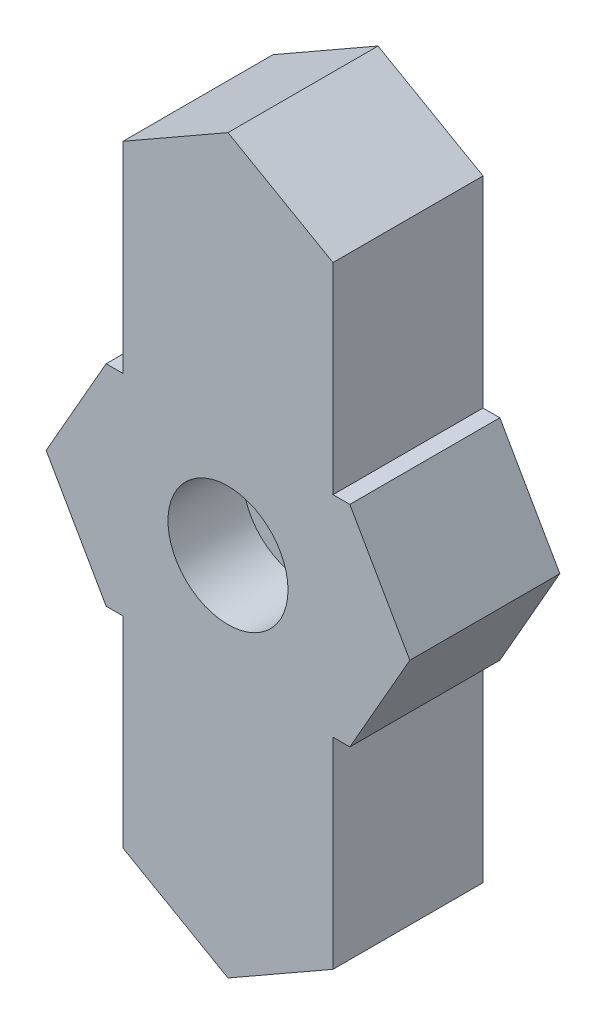
from build123d import *

# Parameters (mm, degrees)
BOSS_EXTRUDE1_DEPTH  = 12.7
MIRROR2_COPY_1_DEPTH = 12.7
SKETCH2_R            = 5.08
CUT_EXTRUDE1_DEPTH   = 6.35


with BuildPart() as part:
    # Sketch1 → Boss-Extrude1 (new body)
    with BuildSketch(Plane.XY):
        Polygon((0, 0), (-15.3924, 0), (-10.3124, 8.89), (-8.89, 8.89), (-8.89, 25.908), (0, 30.988), align=None)
    boss_extrude1 = extrude(amount=BOSS_EXTRUDE1_DEPTH)

    # Mirror1: Boss-Extrude1 across plane
    add(boss_extrude1.mirror(Plane(origin=(0, 30.988, 12.7), x_dir=(0, 0, 1), z_dir=(-1, 0, 0))))

    # Mirror2: Boss-Extrude1 across plane
    add(boss_extrude1.mirror(Plane(origin=(0, 0, 12.7), x_dir=(0, 0, 1), z_dir=(0, 1, 0))))

    # Mirror2 copy 1 sketch → Mirror2 copy 1 (add)
    with BuildSketch(Plane(origin=(0, 0, 0), x_dir=(-1, 0, 0), z_dir=(0, 0, 1))):
        Polygon((0, 0), (-15.3924, 0), (-10.3124, 8.89), (-8.89, 8.89), (-8.89, 25.908), (0, 30.988), align=None)
    extrude(amount=MIRROR2_COPY_1_DEPTH)

    # Sketch2 → Cut-Extrude1 (cut)
    with BuildSketch(Plane.XY.offset(12.7)):
        Circle(SKETCH2_R)
    extrude(amount=-CUT_EXTRUDE1_DEPTH, mode=Mode.SUBTRACT)


solid = part.part
